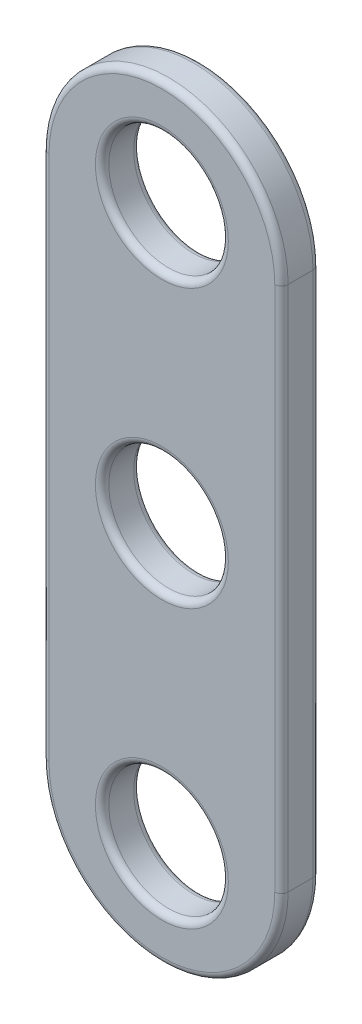
from build123d import *

# Parameters (mm, degrees)
SKETCH1_W           = 31.75
SKETCH1_H           = 101.6
SKETCH1_R           = 7.9375
BOSS_EXTRUDE1_DEPTH = 5.08
FILLET1_RADIUS      = 15.875
FILLET1_LENGTH      = 5.08
FILLET2_RADIUS      = 15.875
FILLET2_LENGTH      = 5.08
FILLET3_R           = 0.889


with BuildPart() as part:
    # Sketch1 → Boss-Extrude1 (new body)
    with BuildSketch(Plane.XY):
        Rectangle(SKETCH1_W, SKETCH1_H)
        with Locations((0, -36.83)):
            Circle(SKETCH1_R, mode=Mode.SUBTRACT)
        Circle(SKETCH1_R, mode=Mode.SUBTRACT)
        with Locations((0, 36.83)):
            Circle(SKETCH1_R, mode=Mode.SUBTRACT)
    extrude(amount=BOSS_EXTRUDE1_DEPTH)

    # Fillet1: full round fillet: the end face becomes a half cylinder, R = half its width
    fillet1_face = Plane((0, 50.8, 2.54), x_dir=(0, 0, 1), z_dir=(0, 1, 0))  # on the end face: x along it, z out of the body
    fillet1_slab = fillet1_face.offset(-FILLET1_RADIUS / 2) * Box(FILLET1_LENGTH, 2 * FILLET1_RADIUS, FILLET1_RADIUS, mode=Mode.PRIVATE)  # the body's end, R deep
    fillet1_round = Plane((0, 34.925, 2.54), x_dir=(0, 1, 0), z_dir=(0, 0, 1)) * Cylinder(FILLET1_RADIUS, FILLET1_LENGTH, mode=Mode.PRIVATE)  # its axis R under the face
    add(fillet1_slab - fillet1_round, mode=Mode.SUBTRACT)

    # Fillet2: full round fillet: the end face becomes a half cylinder, R = half its width
    fillet2_face = Plane((0, -50.8, 2.54), x_dir=(0, 0, 1), z_dir=(0, -1, 0))  # on the end face: x along it, z out of the body
    fillet2_slab = fillet2_face.offset(-FILLET2_RADIUS / 2) * Box(FILLET2_LENGTH, 2 * FILLET2_RADIUS, FILLET2_RADIUS, mode=Mode.PRIVATE)  # the body's end, R deep
    fillet2_round = Plane((0, -34.925, 2.54), x_dir=(0, -1, 0), z_dir=(0, 0, 1)) * Cylinder(FILLET2_RADIUS, FILLET2_LENGTH, mode=Mode.PRIVATE)  # its axis R under the face
    add(fillet2_slab - fillet2_round, mode=Mode.SUBTRACT)

    # Fillet3
    fillet3_edges = [part.edges().sort_by_distance(p)[0] for p in [
        (-7.9375, -36.83, 0),
        (-7.9375, -36.83, 5.08),
        (-7.9375, 0, 0),
        (-7.9375, 0, 5.08),
        (-7.9375, 36.83, 0),
        (-7.9375, 36.83, 5.08),
        (-15.875, 0, 0),
        (-15.875, 0, 5.08),
        (0, 50.8, 0),
        (0, 50.8, 5.08),
        (15.875, 0, 0),
        (15.875, 0, 5.08),
        (0, -50.8, 0),
        (0, -50.8, 5.08),
    ]]
    fillet(fillet3_edges, radius=FILLET3_R)


solid = part.part
